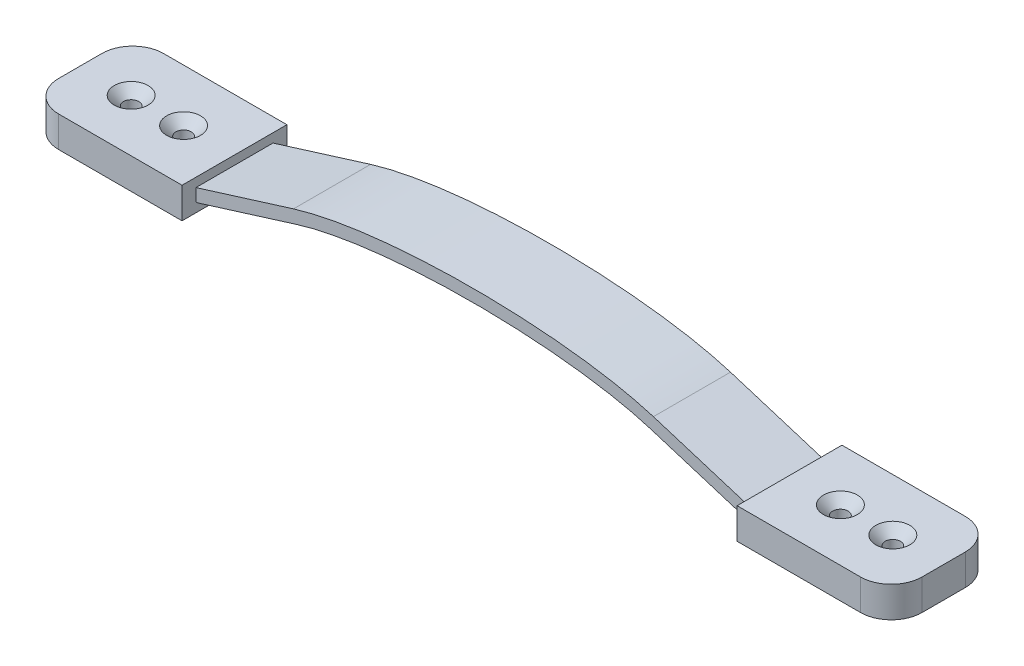
from build123d import *

# Parameters (mm, degrees)
SKETCH1_W             = 50
SKETCH1_H             = 34
BOSS_EXTRUDE1_DEPTH   = 10
BOSS_EXTRUDE1_2_DEPTH = 10
FILLET1_R             = 10
FILLET2_R             = 10
BOSS_EXTRUDE2_DEPTH   = 12.5
SKETCH4_R             = 2.5
CUT_EXTRUDE1_DEPTH    = 283.391465155
CHAMFER1_SIZE         = 3


with BuildPart() as part:
    # Sketch1 → Boss-Extrude1 (new body)
    with BuildSketch(Plane(origin=(0, 0, 0), x_dir=(1, 0, 0), z_dir=(0, 1, 0))):
        with Locations((25, 17)):
            Rectangle(SKETCH1_W, SKETCH1_H)
    extrude(amount=BOSS_EXTRUDE1_DEPTH)

    # Fillet1
    fillet1_edges = [part.edges().sort_by_distance(p)[0] for p in [
        (0, 5, -34),
        (0, 5, 0),
    ]]
    fillet(fillet1_edges, radius=FILLET1_R)



with BuildPart() as body_2:
    # Sketch1 → Boss-Extrude1 2 (new body)
    with BuildSketch(Plane(origin=(0, 0, 0), x_dir=(1, 0, 0), z_dir=(0, 1, 0))):
        with Locations((255, 17)):
            Rectangle(SKETCH1_W, SKETCH1_H)
    extrude(amount=BOSS_EXTRUDE1_2_DEPTH)

    # Fillet2
    fillet2_edges = [body_2.edges().sort_by_distance(p)[0] for p in [
        (280, 5, -34),
        (280, 5, 0),
    ]]
    fillet(fillet2_edges, radius=FILLET2_R)


with BuildPart() as part_1:
    add(part.part)

    add(body_2.part)  # Boss-Extrude2 merges body 2
    # Sketch3 → Boss-Extrude2 (add, symmetric)
    with BuildSketch(Plane.XY.offset(-17)):
        with BuildLine():
            Line((230, 7.094420761), (198.356689293, 16.93185641))
            add(Edge.make_bspline(
                [(198.356689293, 16.93185641), (197.921485468, 17.06715482), (197.058320029, 17.327430882), (195.247018989, 17.842283694), (192.878899734, 18.458259291), (189.862315722, 19.156901641), (185.625111362, 20.030310935), (179.946744848, 21.009637357), (172.608544526, 21.991371788), (164.84084187, 22.767908957), (154.046889349, 23.517083016), (140, 23.897827649), (125.953110651, 23.517083016), (115.15915813, 22.767908957), (107.391455474, 21.991371788), (100.053255152, 21.009637357), (94.374888638, 20.030310935), (90.137684278, 19.156901641), (87.121100266, 18.458259291), (84.752981011, 17.842283694), (82.941679971, 17.327430882), (82.078514532, 17.06715482), (81.643310707, 16.93185641)],
                knots=[0.641614074, 0.641614074, 0.641614074, 0.641614074, 0.67065102, 0.699687965, 0.757761856, 0.815835747, 0.873909637, 0.990057419, 1.106205201, 1.222352982, 1.338500764, 1.570796327, 1.80309189, 1.919239671, 2.035387453, 2.151535235, 2.267683016, 2.325756907, 2.383830798, 2.441904688, 2.470941634, 2.499978579, 2.499978579, 2.499978579, 2.499978579], degree=3))
            Line((81.643310707, 16.93185641), (50, 7.094420761))
            Line((50, 7.094420761), (50, 3.090164081))
            Line((50, 3.090164081), (50.593739641, 3.090164081))
            Line((50.593739641, 3.090164081), (82.83078999, 13.112184572))
            add(Edge.make_bspline(
                [(197.16921001, 13.112184572), (196.755159459, 13.240906743), (195.935388877, 13.488101862), (194.203464644, 13.980443227), (191.927236958, 14.572619906), (189.009827951, 15.248400933), (184.89320594, 16.097058438), (179.347389143, 17.053860827), (172.148362972, 18.017197671), (164.506098732, 18.781331097), (153.867128529, 19.519872284), (140, 19.895968137), (126.132871471, 19.519872284), (115.493901268, 18.781331097), (107.851637028, 18.017197671), (100.652610857, 17.053860827), (95.10679406, 16.097058438), (90.990172049, 15.248400933), (88.072763042, 14.572619906), (85.796535356, 13.980443227), (84.064611123, 13.488101862), (83.244840541, 13.240906743), (82.83078999, 13.112184572)],
                knots=[0.641614074, 0.641614074, 0.641614074, 0.641614074, 0.67065102, 0.699687965, 0.757761856, 0.815835747, 0.873909637, 0.990057419, 1.106205201, 1.222352982, 1.338500764, 1.570796327, 1.80309189, 1.919239671, 2.035387453, 2.151535235, 2.267683016, 2.325756907, 2.383830798, 2.441904688, 2.470941634, 2.499978579, 2.499978579, 2.499978579, 2.499978579], degree=3))
            Line((197.16921001, 13.112184572), (229.406260359, 3.090164081))
            Line((229.406260359, 3.090164081), (230, 3.090164081))
            Line((230, 3.090164081), (230, 7.094420761))
        make_face()
    extrude(amount=BOSS_EXTRUDE2_DEPTH, both=True)

    # Sketch4 → Cut-Extrude1 (cut, through all)
    with BuildSketch(Plane(origin=(0, 10, 0), x_dir=(1, 0, 0), z_dir=(0, 1, 0))):
        with Locations(Location((16.5, 17, 0), (0, 0, 270))):
            Circle(SKETCH4_R)
        with Locations(Location((33.5, 17, 0), (0, 0, 270))):
            Circle(SKETCH4_R)
        with Locations(Location((246.5, 17, 0), (0, 0, 270))):
            Circle(SKETCH4_R)
        with Locations(Location((263.5, 17, 0), (0, 0, 270))):
            Circle(SKETCH4_R)
    extrude(amount=-CUT_EXTRUDE1_DEPTH, mode=Mode.SUBTRACT)

    # Chamfer1
    chamfer1_edges = [part_1.edges().sort_by_distance(p)[0] for p in [
        (16.5, 10, -19.5),
        (33.5, 10, -19.5),
        (246.5, 10, -19.5),
        (263.5, 10, -19.5),
    ]]
    chamfer(chamfer1_edges, length=CHAMFER1_SIZE)


solid = part_1.part
